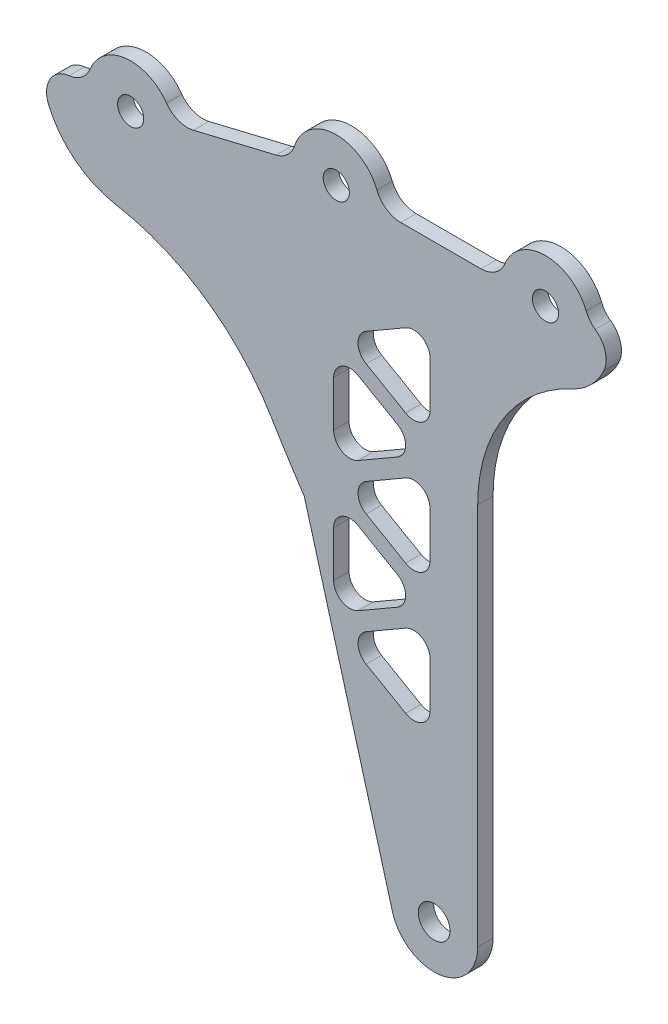
from build123d import *

# Parameters (mm, degrees)
SKETCH_1_R      = 2.5527
SKETCH_1_R_2    = 3.1
EXTRUDE_1_DEPTH = 3


with BuildPart() as part:
    # 草图1 → 凸台-拉伸1 (new body)
    with BuildSketch(Plane.XY):
        with BuildLine():
            Line((-431.8, 71.28685299), (-431.8, 146.05))
            ThreePointArc((-431.8, 146.05), (-426.7842688, 163.177211441), (-413.321803354, 174.893053509))
            ThreePointArc((-413.321803354, 174.893053509), (-409.712819047, 177.401355972), (-407.190786251, 181.000758638))
            ThreePointArc((-407.190786251, 181.000758638), (-406.894729782, 184.399778985), (-408.847840186, 187.197340155))
            ThreePointArc((-408.847840186, 187.197340155), (-409.896638803, 188.190326933), (-410.617854885, 189.441665672))
            ThreePointArc((-410.617854885, 189.441665672), (-418.564439883, 194.83685299), (-426.511139528, 189.44183454))
            ThreePointArc((-426.511139528, 189.44183454), (-428.349818055, 187.150121657), (-431.158279177, 186.28685299))
            Line((-431.158279177, 186.28685299), (-446.825059534, 186.28685299))
            ThreePointArc((-446.825059534, 186.28685299), (-449.633520657, 187.150121657), (-451.472199184, 189.44183454))
            ThreePointArc((-451.472199184, 189.44183454), (-459.722204594, 194.831468283), (-467.569172219, 188.870273751))
            ThreePointArc((-467.569172219, 188.870273751), (-468.928502541, 186.721457004), (-471.168900107, 185.519038159))
            Line((-471.168900107, 185.519038159), (-487.317425816, 181.644437971))
            ThreePointArc((-487.317425816, 181.644437971), (-490.249790032, 181.828630192), (-492.572411279, 183.628107117))
            ThreePointArc((-492.572411279, 183.628107117), (-500.567975463, 187.196951214), (-507.510215673, 181.861129284))
            ThreePointArc((-507.510215673, 181.861129284), (-509.113143283, 179.739691752), (-511.576958731, 178.739948001))
            ThreePointArc((-511.576958731, 178.739948001), (-515.326736937, 176.273665509), (-515.587539859, 171.793111105))
            ThreePointArc((-515.587539859, 171.793111105), (-510.367432741, 165.000898725), (-502.544116189, 161.511001094))
            ThreePointArc((-502.544116189, 161.511001094), (-484.948131906, 154.339092671), (-471.954869788, 140.474386658))
            ThreePointArc((-471.954869788, 140.474386658), (-468.883733752, 135.489867956), (-465.668015362, 130.59737795))
            Line((-465.668015362, 130.59737795), (-448.612101008, 69.509501917))
            ThreePointArc((-448.612101008, 69.509501917), (-439.40637216, 62.833958262), (-431.8, 71.28685299))
        make_face()
        with Locations((-459.418807983, 186.28685299)):
            Circle(SKETCH_1_R, mode=Mode.SUBTRACT)
        with Locations((-418.564530728, 186.28685299)):
            Circle(SKETCH_1_R, mode=Mode.SUBTRACT)
        with Locations((-499.563606874, 178.706147734)):
            Circle(SKETCH_1_R, mode=Mode.SUBTRACT)
        with Locations((-440.3, 71.28685299)):
            Circle(SKETCH_1_R_2, mode=Mode.SUBTRACT)
        with BuildLine():
            Line((-441.1092355, 106.511213318), (-441.1092355, 115.413429376))
            ThreePointArc((-441.1092355, 115.413429376), (-442.6967355, 118.163060033), (-445.8717355, 118.163060033))
            Line((-445.8717355, 118.163060033), (-453.581280756, 113.711952004))
            ThreePointArc((-453.581280756, 113.711952004), (-455.168780756, 110.962321347), (-453.581280756, 108.21269069))
            Line((-453.581280756, 108.21269069), (-445.8717355, 103.761582661))
            ThreePointArc((-445.8717355, 103.761582661), (-442.6967355, 103.761582661), (-441.1092355, 106.511213318))
        make_face(mode=Mode.SUBTRACT)
        with BuildLine():
            Line((-455.168781337, 116.461582661), (-447.459236081, 120.91269069))
            ThreePointArc((-447.459236081, 120.91269069), (-445.871736081, 123.662321347), (-447.459236081, 126.411952004))
            Line((-447.459236081, 126.411952004), (-455.168781337, 130.863060033))
            ThreePointArc((-455.168781337, 130.863060033), (-458.343781337, 130.863060033), (-459.931281337, 128.113429376))
            Line((-459.931281337, 128.113429376), (-459.931281337, 119.211213318))
            ThreePointArc((-459.931281337, 119.211213318), (-458.343781337, 116.461582661), (-455.168781337, 116.461582661))
        make_face(mode=Mode.SUBTRACT)
        with BuildLine():
            Line((-441.1092355, 157.311213318), (-441.1092355, 166.213429376))
            ThreePointArc((-441.1092355, 166.213429376), (-442.6967355, 168.963060033), (-445.8717355, 168.963060033))
            Line((-445.8717355, 168.963060033), (-453.581280756, 164.511952004))
            ThreePointArc((-453.581280756, 164.511952004), (-455.168780756, 161.762321347), (-453.581280756, 159.01269069))
            Line((-453.581280756, 159.01269069), (-445.8717355, 154.561582661))
            ThreePointArc((-445.8717355, 154.561582661), (-442.6967355, 154.561582661), (-441.1092355, 157.311213318))
        make_face(mode=Mode.SUBTRACT)
        with BuildLine():
            Line((-441.1092355, 131.911213318), (-441.1092355, 140.813429376))
            ThreePointArc((-441.1092355, 140.813429376), (-442.6967355, 143.563060033), (-445.8717355, 143.563060033))
            Line((-445.8717355, 143.563060033), (-453.581280756, 139.111952004))
            ThreePointArc((-453.581280756, 139.111952004), (-455.168780756, 136.362321347), (-453.581280756, 133.61269069))
            Line((-453.581280756, 133.61269069), (-445.8717355, 129.161582661))
            ThreePointArc((-445.8717355, 129.161582661), (-442.6967355, 129.161582661), (-441.1092355, 131.911213318))
        make_face(mode=Mode.SUBTRACT)
        with BuildLine():
            Line((-455.168781337, 141.861582661), (-447.459236081, 146.31269069))
            ThreePointArc((-447.459236081, 146.31269069), (-445.871736081, 149.062321347), (-447.459236081, 151.811952004))
            Line((-447.459236081, 151.811952004), (-455.168781337, 156.263060033))
            ThreePointArc((-455.168781337, 156.263060033), (-458.343781337, 156.263060033), (-459.931281337, 153.513429376))
            Line((-459.931281337, 153.513429376), (-459.931281337, 144.611213318))
            ThreePointArc((-459.931281337, 144.611213318), (-458.343781337, 141.861582661), (-455.168781337, 141.861582661))
        make_face(mode=Mode.SUBTRACT)
    extrude(amount=EXTRUDE_1_DEPTH)


solid = part.part
